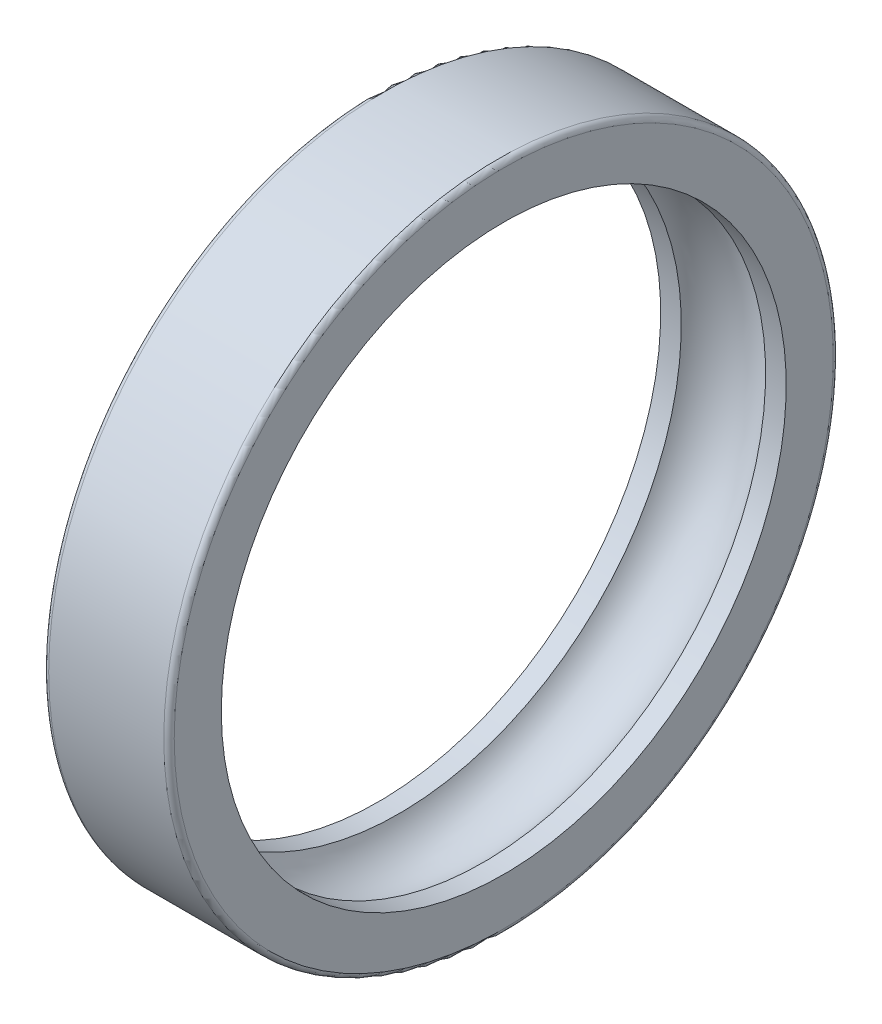
from build123d import *

# Parameters (mm, degrees)
FILLET1_R    = 5
SCALE1_SCALE = 0.277777778


with BuildPart() as part:
    # Sketch2 → Revolve1 (revolve)
    with BuildSketch(Plane.XY, mode=Mode.PRIVATE) as revolve1_sk:
        with BuildLine():
            Line((40.311288741, 270), (60, 270))
            Line((60, 270), (60, 320))
            Line((60, 320), (-60, 320))
            Line((-60, 320), (-60, 270))
            Line((-60, 270), (-40.311288741, 270))
            ThreePointArc((-40.311288741, 270), (0, 295), (40.311288741, 270))
        make_face()
    revolve(revolve1_sk.sketch.rotate(Axis((-83.864002629, 0, 0), (1, 0, 0)), 90), axis=Axis((-83.864002629, 0, 0), (1, 0, 0)))

    # Fillet1
    fillet1_edges = [part.edges().sort_by_distance(p)[0] for p in [
        (-60, 0, -320),
        (60, 0, -320),
    ]]
    fillet(fillet1_edges, radius=FILLET1_R)


with BuildPart() as part_1:
    # Scale1: scaled about (0, 0, 0)
    add(part.part.scale(SCALE1_SCALE))


solid = part_1.part
